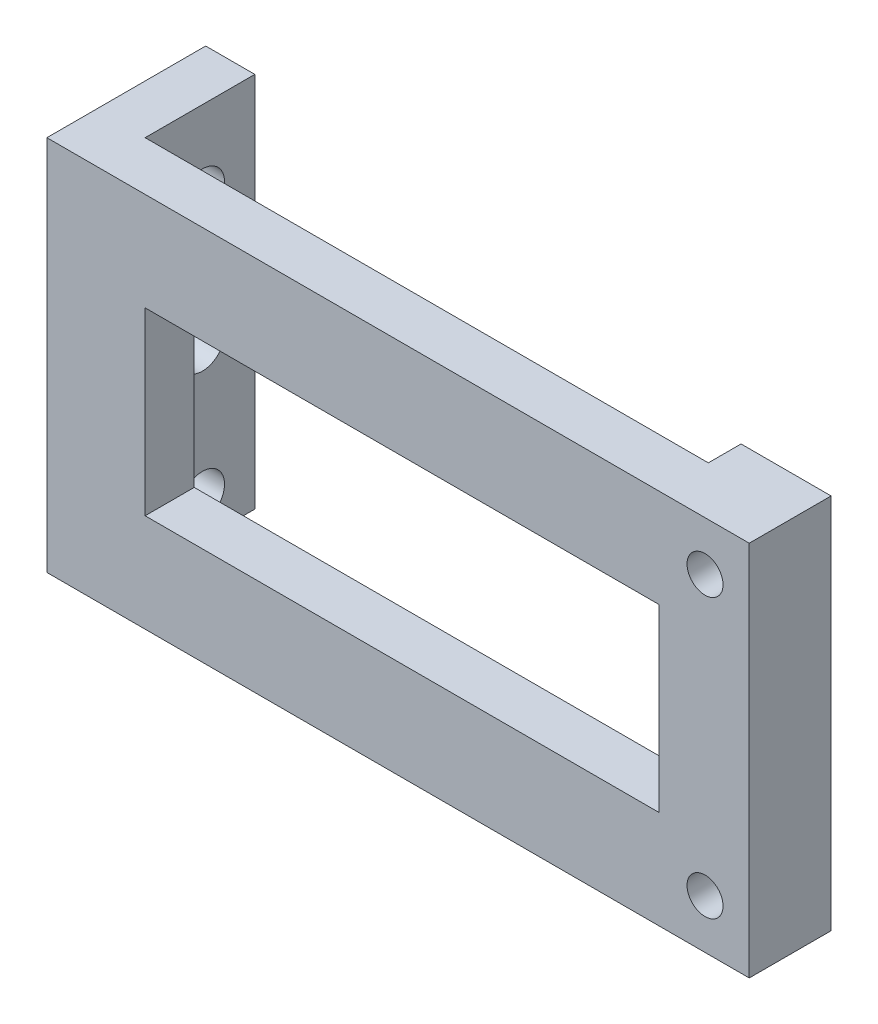
from build123d import *

# Parameters (mm, degrees)
BOSS_EXTRUDE1_DEPTH = 3
SKETCH1_3_R         = 1.1
BOSS_EXTRUDE2_DEPTH = 5
SKETCH1_4_W         = 3
SKETCH1_4_H         = 23
BOSS_EXTRUDE3_DEPTH = 9.7
SKETCH2_R           = 1.35
CUT_EXTRUDE1_DEPTH  = 3
LPATTERN1_COUNT     = 3
LPATTERN1_PITCH     = 8


with BuildPart() as part:
    # Sketch1 → Boss-Extrude1 (new body)
    with BuildSketch(Plane.XY):
        Polygon((15.95, 5.5), (15.95, 11.5), (-18.45, 11.5), (-18.45, -11.5), (15.95, -11.5), (15.95, -5.5), (-15.45, -5.5), (-15.45, 5.5), align=None)
    extrude(amount=-BOSS_EXTRUDE1_DEPTH)

    # Sketch1<3> → Boss-Extrude2 (add)
    with BuildSketch(Plane.XY):
        Polygon((21.45, -11.5), (21.45, 11.5), (15.95, 11.5), (15.95, 5.5), (15.95, -5.5), (15.95, -11.5), align=None)
        with Locations((18.75, -8.5)):
            Circle(SKETCH1_3_R, mode=Mode.SUBTRACT)
        with Locations((18.75, 8.5)):
            Circle(SKETCH1_3_R, mode=Mode.SUBTRACT)
    extrude(amount=-BOSS_EXTRUDE2_DEPTH)

    # Sketch1<4> → Boss-Extrude3 (add)
    with BuildSketch(Plane.XY):
        with Locations((-19.95, 0)):
            Rectangle(SKETCH1_4_W, SKETCH1_4_H)
    extrude(amount=-BOSS_EXTRUDE3_DEPTH)

    # Sketch2 → Cut-Extrude1 (cut)
    with BuildSketch(Plane.ZY.offset(21.45)):
        with Locations(Location((-6.5, 6.75, 0), (0, 0, 270))):
            Circle(SKETCH2_R)
    cut_extrude1 = extrude(amount=-CUT_EXTRUDE1_DEPTH, mode=Mode.SUBTRACT)

    # LPattern1: Cut-Extrude1 ×3
    with Locations(*[(0, -i * LPATTERN1_PITCH, 0) for i in range(1, LPATTERN1_COUNT)]):
        add(cut_extrude1, mode=Mode.SUBTRACT)


solid = part.part
